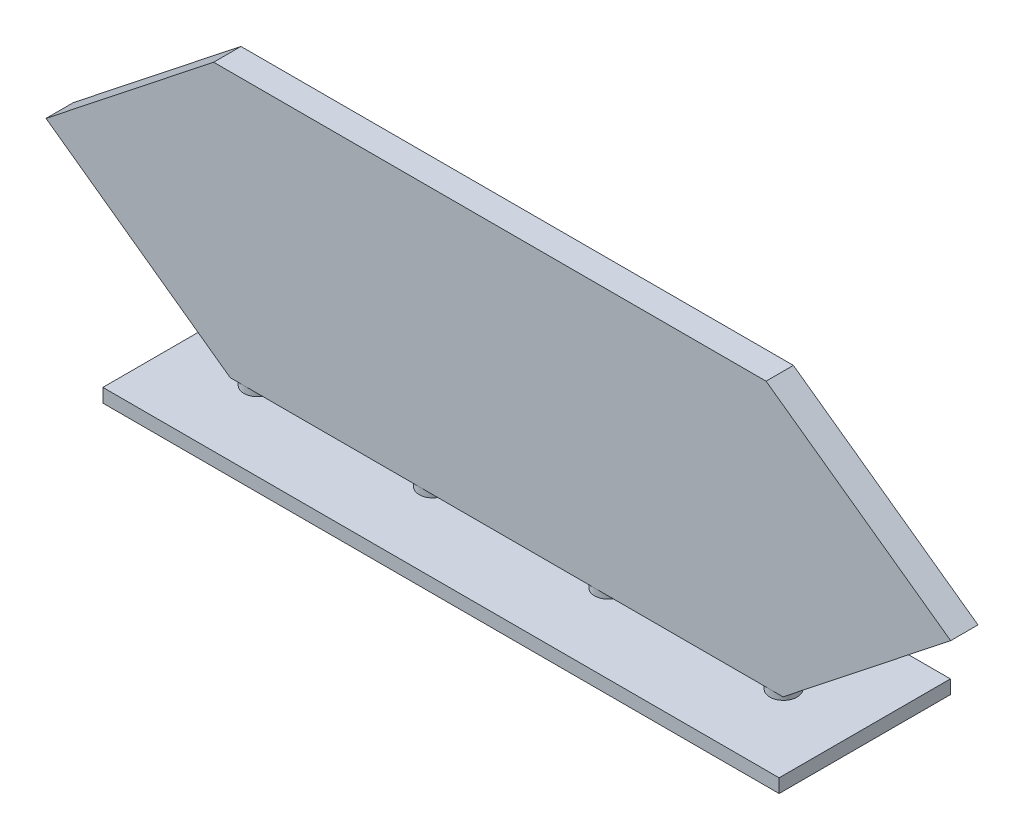
from build123d import *

# Parameters (mm, degrees)
EXTRUDE_1_DEPTH       = 1.2
CUT_EXTRUDE_1_DEPTH   = 1.2
CUT_EXTRUDE_1_2_DEPTH = 1.2
SKETCH_4_R            = 0.6
EXTRUDE_2_DEPTH       = 0.3
SKETCH_5_W            = 29.699213112
SKETCH_5_H            = 7.523800655
EXTRUDE_3_DEPTH       = 0.6


with BuildPart() as part:
    # Эскиз1 → Бобышка-Вытянуть1 (new body)
    with BuildSketch(Plane.XY):
        Polygon((-12.686954911, 6.182258949), (-20.530403447, -0.015033721), (-11.90549662, -6.217213911), (12.642254234, -6.217213911), (20.530403447, 0.015397813), (11.886622261, 6.217213911), (-13.761189247, 6.217213911), align=None)
    extrude(amount=EXTRUDE_1_DEPTH)

    # Эскиз2 → Cut-Extrude 1 (cut)
    with BuildSketch(Plane.XY.offset(1.2)):
        Polygon((-12.686954911, 6.182258949), (-13.761189247, 6.217213911), (-12.642715038, 6.217213911), align=None)
    extrude(amount=-CUT_EXTRUDE_1_DEPTH, mode=Mode.SUBTRACT)

    # Эскиз3 → Cut-Extrude 1 2 (cut)
    with BuildSketch(Plane.XY.offset(1.2)):
        Polygon((11.886622261, 6.217213911), (-12.642715038, 6.217213911), (-20.530403447, -0.015033721), (-11.90549662, -6.217213911), (12.642254234, -6.217213911), (20.530403447, 0.015397813), align=None)
        Polygon((11.757969034, 5.817213911), (-12.503760371, 5.817213911), (-19.866171727, 0), (-11.776608632, -5.817213911), (12.503299567, -5.817213911), (19.865710923, 0), align=None, mode=Mode.SUBTRACT)
    extrude(amount=-CUT_EXTRUDE_1_2_DEPTH, mode=Mode.SUBTRACT)

    # Эскиз4 → Бобышка-Вытянуть2 (add)
    with BuildSketch(Plane.XZ.offset(5.817213911)):
        with Locations(Location((-11.176608632, 0.6, 0), (0, 0, 270))):
            Circle(SKETCH_4_R)
        with Locations(Location((-3.476608632, 0.6, 0), (0, 0, 270))):
            Circle(SKETCH_4_R)
        with Locations(Location((4.223391368, 0.6, 0), (0, 0, 270))):
            Circle(SKETCH_4_R)
        with Locations(Location((11.923391368, 0.6, 0), (0, 0, 270))):
            Circle(SKETCH_4_R)
    extrude(amount=EXTRUDE_2_DEPTH)

    # Эскиз5 → Бобышка-Вытянуть3 (add)
    with BuildSketch(Plane.XZ.offset(6.117213911)):
        with Locations((0.346260417, 0.303007868)):
            Rectangle(SKETCH_5_W, SKETCH_5_H)
    extrude(amount=EXTRUDE_3_DEPTH)


solid = part.part
